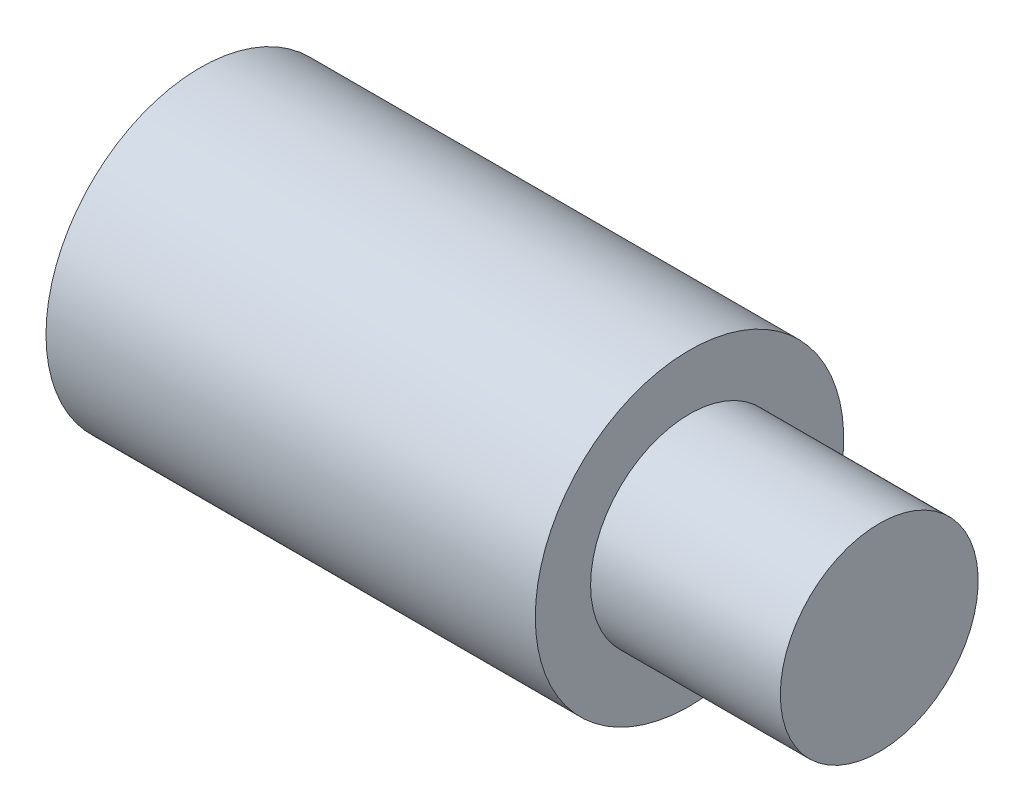
from build123d import *

# Parameters (mm, degrees)
SOCKET_SKETCH_W = 16.2
SOCKET_SKETCH_H = 3.175


with BuildPart() as part:
    # Conn_T4_ORB4 Sketch → Conn_T4_ORB4 (revolve)
    with BuildSketch(Plane.XY):
        Polygon((9.5, 0), (9.5, 4.953), (0, 4.953), (0, 7.722), (-24.5, 7.722), (-24.5, 0), align=None)
    revolve(axis=Axis((-1000, 0, 0), (1, 0, 0)))

    # Socket Sketch → Socket (revolve, cut)
    with BuildSketch(Plane.XY):
        with Locations((-17.4, 1.5875)):
            Rectangle(SOCKET_SKETCH_W, SOCKET_SKETCH_H)
    revolve(axis=Axis((-1000, 0, 0), (1, 0, 0)), mode=Mode.SUBTRACT)


solid = part.part
